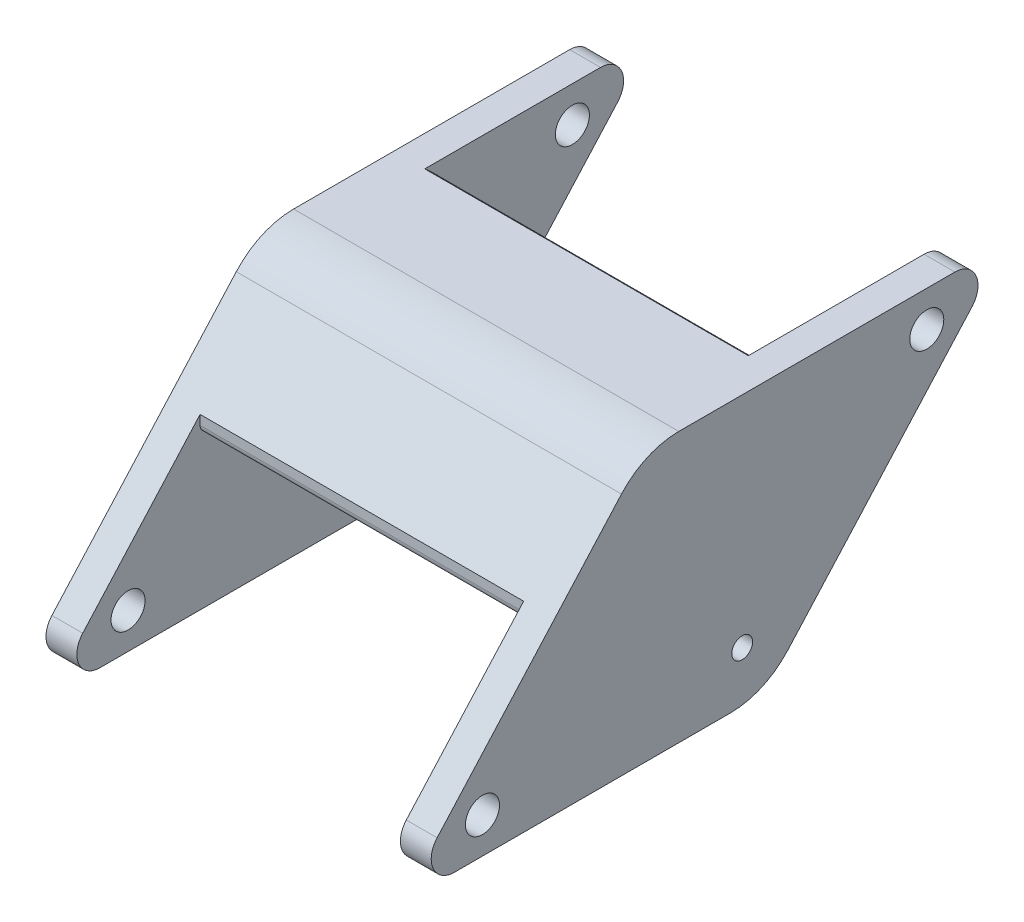
from build123d import *

# Parameters (mm, degrees)
SKETCH4_R            = 3.6
THICKBASE_DEPTH      = 4
MIDDLE_DEPTH         = 42
THINBASE_DEPTH       = 4
SKETCH8_R            = 1.35
RETAINERSCREW_DEPTH  = 4
SKETCH9_R            = 3
SKETCH9_R_2          = 1.35
SPACER_DEPTH         = 8.2
SKETCH15_W           = 42
SKETCH15_H           = 16
CUT_EXTRUDE_H1_DEPTH = 77.519145025
SKETCH17_W           = 42
SKETCH17_H           = 16
CUT_EXTRUDE_H2_DEPTH = 75.830901411
FILLET_R1_R          = 1
FILLET_R2_R          = 1
SKETCH18_R           = 2.21
SIDESCREWS_DEPTH     = 71.502298398


with BuildPart() as part:
    # Sketch4 → ThickBase (new body)
    with BuildSketch(Plane(origin=(0, 0, 0), x_dir=(0, 0, -1), z_dir=(1, 0, 0))):
        with BuildLine():
            Line((-14.01318338, 16.550216151), (21.822267157, 16.550216151))
            ThreePointArc((21.822267157, 16.550216151), (24.561793845, 14.77291543), (24.055345362, 11.546878503))
            Line((24.055345362, 11.546878503), (0.125176293, -15.12757601))
            ThreePointArc((0.125176293, -15.12757601), (-3.242753458, -17.581539475), (-7.318417722, -18.449783849))
            Line((-7.318417722, -18.449783849), (-43.153868259, -18.449783849))
            ThreePointArc((-43.153868259, -18.449783849), (-45.893394947, -16.672483128), (-45.386946464, -13.446446201))
            Line((-45.386946464, -13.446446201), (-21.456777395, 13.228008312))
            ThreePointArc((-21.456777395, 13.228008312), (-18.088847644, 15.681971777), (-14.01318338, 16.550216151))
        make_face()
        with Locations((-5.952745457, -11.509649573)):
            Circle(SKETCH4_R, mode=Mode.SUBTRACT)
    extrude(amount=THICKBASE_DEPTH)

    # Sketch5 → Middle (add)
    with BuildSketch(Plane(origin=(4, 0, 0), x_dir=(0, 0, -1), z_dir=(1, 0, 0))):
        with BuildLine():
            Line((15.945305194, 2.506787856), (24.055345362, 11.546878503))
            ThreePointArc((24.055345362, 11.546878503), (24.561793845, 14.77291543), (21.822267157, 16.550216151))
            Line((21.822267157, 16.550216151), (-14.01318338, 16.550216151))
            ThreePointArc((-14.01318338, 16.550216151), (-18.088847644, 15.681971777), (-21.456777395, 13.228008312))
            Line((-21.456777395, 13.228008312), (-45.386946464, -13.446446201))
            ThreePointArc((-45.386946464, -13.446446201), (-45.893394947, -16.672483128), (-43.153868259, -18.449783849))
            Line((-43.153868259, -18.449783849), (-31.009075531, -18.449783849))
            ThreePointArc((-31.009075531, -18.449783849), (-16.549356077, 12.232654103), (15.945305194, 2.506787856))
        make_face()
    extrude(amount=MIDDLE_DEPTH)

    # Sketch7 → ThinBase (add)
    with BuildSketch(Plane(origin=(46, 0, 0), x_dir=(0, 0, -1), z_dir=(1, 0, 0))):
        with BuildLine():
            ThreePointArc((15.945305194, 2.506787856), (-16.549356077, 12.232654103), (-31.009075531, -18.449783849))
            Line((-31.009075531, -18.449783849), (-7.318417722, -18.449783849))
            ThreePointArc((-7.318417722, -18.449783849), (-3.242753458, -17.581539475), (0.125176293, -15.12757601))
            Line((0.125176293, -15.12757601), (15.945305194, 2.506787856))
        make_face()
        with BuildLine():
            Line((-43.153868259, -18.449783849), (-31.009075531, -18.449783849))
            ThreePointArc((-31.009075531, -18.449783849), (-16.549356077, 12.232654103), (15.945305194, 2.506787856))
            Line((15.945305194, 2.506787856), (24.055345362, 11.546878503))
            ThreePointArc((24.055345362, 11.546878503), (24.561793845, 14.77291543), (21.822267157, 16.550216151))
            Line((21.822267157, 16.550216151), (-14.01318338, 16.550216151))
            ThreePointArc((-14.01318338, 16.550216151), (-18.088847644, 15.681971777), (-21.456777395, 13.228008312))
            Line((-21.456777395, 13.228008312), (-45.386946464, -13.446446201))
            ThreePointArc((-45.386946464, -13.446446201), (-45.893394947, -16.672483128), (-43.153868259, -18.449783849))
        make_face()
    extrude(amount=THINBASE_DEPTH)

    # Sketch8 → RetainerScrew (cut)
    with BuildSketch(Plane(origin=(50, 0, 0), x_dir=(0, 0, -1), z_dir=(1, 0, 0))):
        with Locations((-5.789718886, -11.874919798)):
            Circle(SKETCH8_R)
    extrude(amount=-RETAINERSCREW_DEPTH, mode=Mode.SUBTRACT)

    # Sketch9 → Spacer (add)
    with BuildSketch(Plane.ZY.offset(-46)):
        with Locations(Location((5.789718886, -11.874919798, 0), (0, 0, 180))):
            Circle(SKETCH9_R)
        with Locations(Location((5.789718886, -11.874919798, 0), (0, 0, 180))):
            Circle(SKETCH9_R_2, mode=Mode.SUBTRACT)
    extrude(amount=SPACER_DEPTH)

    # Sketch15 → Cut-Extrude H1 (cut, through all)
    with BuildSketch(Plane(origin=(0, 16.550216151, 0), x_dir=(1, 0, 0), z_dir=(0, 1, 0))):
        with Locations((25, -38.153868259)):
            Rectangle(SKETCH15_W, SKETCH15_H)
    extrude(amount=-CUT_EXTRUDE_H1_DEPTH, mode=Mode.SUBTRACT)

    # Sketch17 → Cut-Extrude H2 (cut, through all)
    with BuildSketch(Plane(origin=(0, 16.564225392, 18.463792524), x_dir=(1, 0, 0), z_dir=(0, 0.6677792161146302, 0.7443594014488768))):
        with Locations((25, 19.65868724)):
            Rectangle(SKETCH17_W, SKETCH17_H)
    extrude(amount=-CUT_EXTRUDE_H2_DEPTH, mode=Mode.SUBTRACT)

    # Fillet R1
    fillet_r1_edges = [part.edges().sort_by_distance(p)[0] for p in [
        (25, -2.007502678, 30.153868259),
    ]]
    fillet(fillet_r1_edges, radius=FILLET_R1_R)

    # Fillet R2
    fillet_r2_edges = [part.edges().sort_by_distance(p)[0] for p in [
        (25, 12.850019915, -3.135248981),
    ]]
    fillet(fillet_r2_edges, radius=FILLET_R2_R)

    # Sketch18 → SideScrews (cut, through all)
    with BuildSketch(Plane(origin=(50, 0, 0), x_dir=(0, 0, -1), z_dir=(1, 0, 0))):
        with Locations((-39.501166009, -13.819518143)):
            Circle(SKETCH18_R)
        with Locations((18.169564907, 11.919950445)):
            Circle(SKETCH18_R)
    extrude(amount=-SIDESCREWS_DEPTH, mode=Mode.SUBTRACT)


solid = part.part
